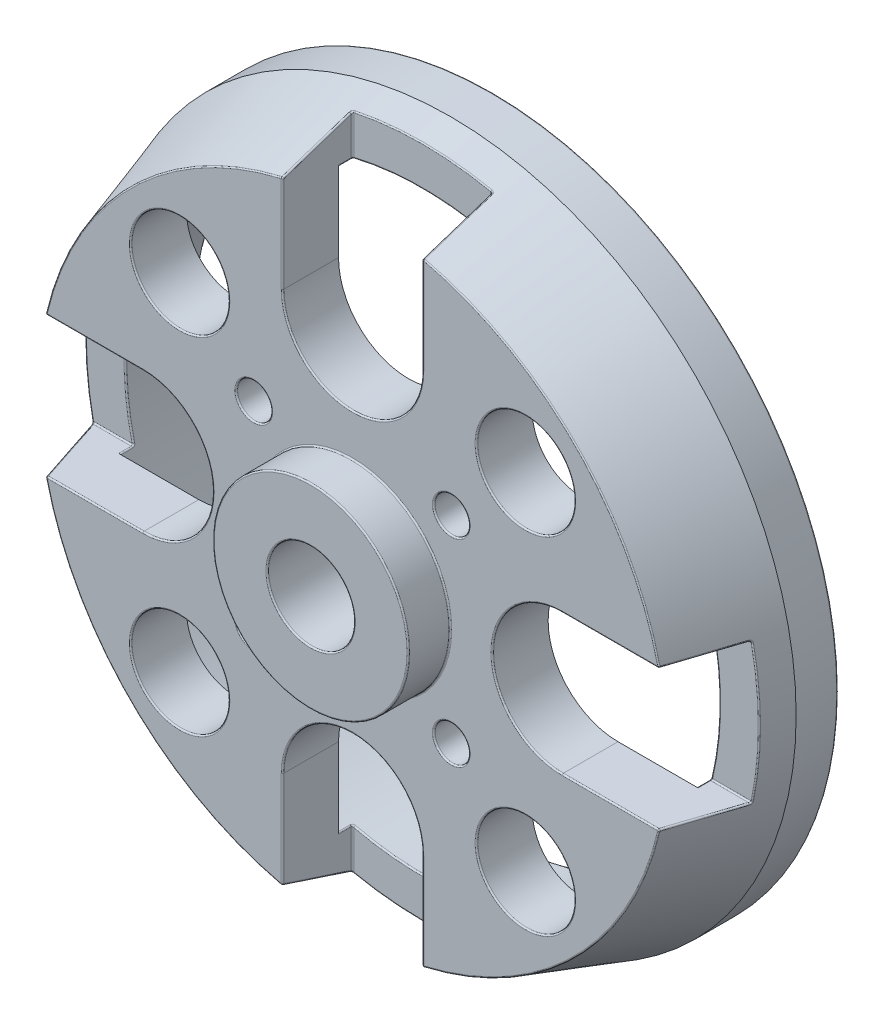
from build123d import *

# Parameters (mm, degrees)
SKETCH_1_R          = 24.75
EXTRUDE_1_DEPTH     = 3
SKETCH_2_R          = 22.5
SKETCH_3_R          = 7
EXTRUDE_2_DEPTH     = 3
SKETCH_4_R          = 3.5
CUT_EXTRUDE_1_DEPTH = 5
SKETCH_5_R          = 21.25
CUT_EXTRUDE_2_DEPTH = 6
M3X0_51_D           = 2.5
SKETCH_9_R          = 3.1
CUT_EXTRUDE_3_DEPTH = 38.337983474
FILLET_1_R          = 0.1


with BuildPart() as part:
    # Эскиз1 → Бобышка-Вытянуть1 (new body)
    with BuildSketch(Plane.XY):
        Circle(SKETCH_1_R)
    extrude(amount=EXTRUDE_1_DEPTH)

    # Эскиз2 → section 1 of loft_1
    with BuildSketch(Plane.XY.offset(10), mode=Mode.PRIVATE) as loft_1_s1:
        Circle(SKETCH_2_R)
    # loft up to a face of the part (loft_1)
    loft([Face(Wire([part.edges().sort_by_distance((-16.942540872, 18.041973529, 3))[0]])), loft_1_s1.sketch])

    # Эскиз3 → Бобышка-Вытянуть2 (add)
    with BuildSketch(Plane.XY.offset(10)):
        Circle(SKETCH_3_R)
    extrude(amount=EXTRUDE_2_DEPTH)

    # Эскиз4 → Вырез-Вытянуть1 (cut)
    with BuildSketch(Plane.XY.offset(10)):
        with Locations((-12.374368671, 12.374368671)):
            Circle(SKETCH_4_R)
        with Locations((12.374368671, 12.374368671)):
            Circle(SKETCH_4_R)
        with Locations((12.374368671, -12.374368671)):
            Circle(SKETCH_4_R)
        with Locations((-12.374368671, -12.374368671)):
            Circle(SKETCH_4_R)
        with BuildLine():
            Line((-5, 15), (-5, 27.202537425))
            Line((-5, 27.202537425), (5, 27.202537425))
            Line((5, 27.202537425), (5, 15))
            ThreePointArc((5, 15), (0, 10), (-5, 15))
        make_face()
        with BuildLine():
            Line((15, 5), (27.202537425, 5))
            Line((27.202537425, 5), (27.202537425, -5))
            Line((27.202537425, -5), (15, -5))
            ThreePointArc((15, -5), (10, 0), (15, 5))
        make_face()
        with BuildLine():
            Line((5, -15), (5, -27.202537425))
            Line((5, -27.202537425), (-5, -27.202537425))
            Line((-5, -27.202537425), (-5, -15))
            ThreePointArc((-5, -15), (0, -10), (5, -15))
        make_face()
        with BuildLine():
            Line((-15, -5), (-27.202537425, -5))
            Line((-27.202537425, -5), (-27.202537425, 5))
            Line((-27.202537425, 5), (-15, 5))
            ThreePointArc((-15, 5), (-10, 0), (-15, -5))
        make_face()
    extrude(amount=-CUT_EXTRUDE_1_DEPTH, mode=Mode.SUBTRACT)

    # Эскиз5 → Вырез-Вытянуть2 (cut)
    with BuildSketch(Plane(origin=(0, 0, 0), x_dir=(-1, 0, 0), z_dir=(0, 0, -1))):
        Circle(SKETCH_5_R)
    extrude(amount=-CUT_EXTRUDE_2_DEPTH, mode=Mode.SUBTRACT)

    # Отверстие обработанное метчиком M3x0.51 (through all)
    with Locations(Plane.XY.offset(10)):
        with Locations((-7.071067812, 7.071067812), (7.071067812, 7.071067812), (7.071067812, -7.071067812), (-7.071067812, -7.071067812)):
            Hole(M3X0_51_D / 2)

    # Эскиз9 → Вырез-Вытянуть3 (cut, through all)
    with BuildSketch(Plane.XY.offset(13)):
        Circle(SKETCH_9_R)
    extrude(amount=-CUT_EXTRUDE_3_DEPTH, mode=Mode.SUBTRACT)

    # Скругление1
    fillet_1_edges = [part.edges().sort_by_distance(p)[0] for p in [
        (-24.75, 0, 0),
        (21.25, 0, 0),
        (23.975730136, 2.513702682, 5),
        (22.760786282, 5, 7.500203538),
        (15.909902577, 15.909902577, 10),
        (5, 22.760786282, 7.500203538),
        (0, 24.107142857, 5),
        (-5, 22.760786282, 7.500203538),
        (-15.909902577, 15.909902577, 10),
        (-22.760786282, 5, 7.500203538),
        (-24.107142857, 0, 5),
        (-22.760786282, -5, 7.500203538),
        (-15.909902577, -15.909902577, 10),
        (-5, -22.760786282, 7.500203538),
        (0, -24.107142857, 5),
        (5, -22.760786282, 7.500203538),
        (15.909902577, -15.909902577, 10),
        (22.760786282, -5, 7.500203538),
        (23.975730136, -2.513702682, 5),
        (-21.100320234, -2.5177343, 5),
        (-20.653389552, -5, 5.5),
        (-5, -20.653389552, 5.5),
        (0, -21.25, 5),
        (5, -20.653389552, 5.5),
        (20.653389552, -5, 5.5),
        (21.25, 0, 5),
        (20.653389552, 5, 5.5),
        (5, 20.653389552, 5.5),
        (0, 21.25, 5),
        (-5, 20.653389552, 5.5),
        (-20.653389552, 5, 5.5),
        (-21.100320234, 2.5177343, 5),
        (22.118157119, -5, 5),
        (22.118157119, 5, 5),
        (18.468705484, 5, 10),
        (10, 0, 10),
        (18.468705484, -5, 10),
        (5, 18.468705484, 10),
        (0, 10, 10),
        (5, -18.468705484, 10),
        (-5, 18.468705484, 10),
        (0, -10, 10),
        (-5, -18.468705484, 10),
        (-18.468705484, 5, 10),
        (-10, 0, 10),
        (-18.468705484, -5, 10),
        (-15.874368671, -12.374368671, 10),
        (-5.821067812, -7.071067812, 10),
        (-7, 0, 10),
        (8.874368671, -12.374368671, 10),
        (8.321067812, -7.071067812, 10),
        (-5.821067812, 7.071067812, 10),
        (-15.874368671, 12.374368671, 10),
        (8.321067812, 7.071067812, 10),
        (8.874368671, 12.374368671, 10),
        (5, 22.118157119, 5),
        (-5, 22.118157119, 5),
        (-22.118157119, 5, 5),
        (-22.118157119, -5, 5),
        (-5, -22.118157119, 5),
        (5, -22.118157119, 5),
        (-7, 0, 13),
        (-3.1, 0, 13),
    ]]
    fillet(fillet_1_edges, radius=FILLET_1_R)


solid = part.part
